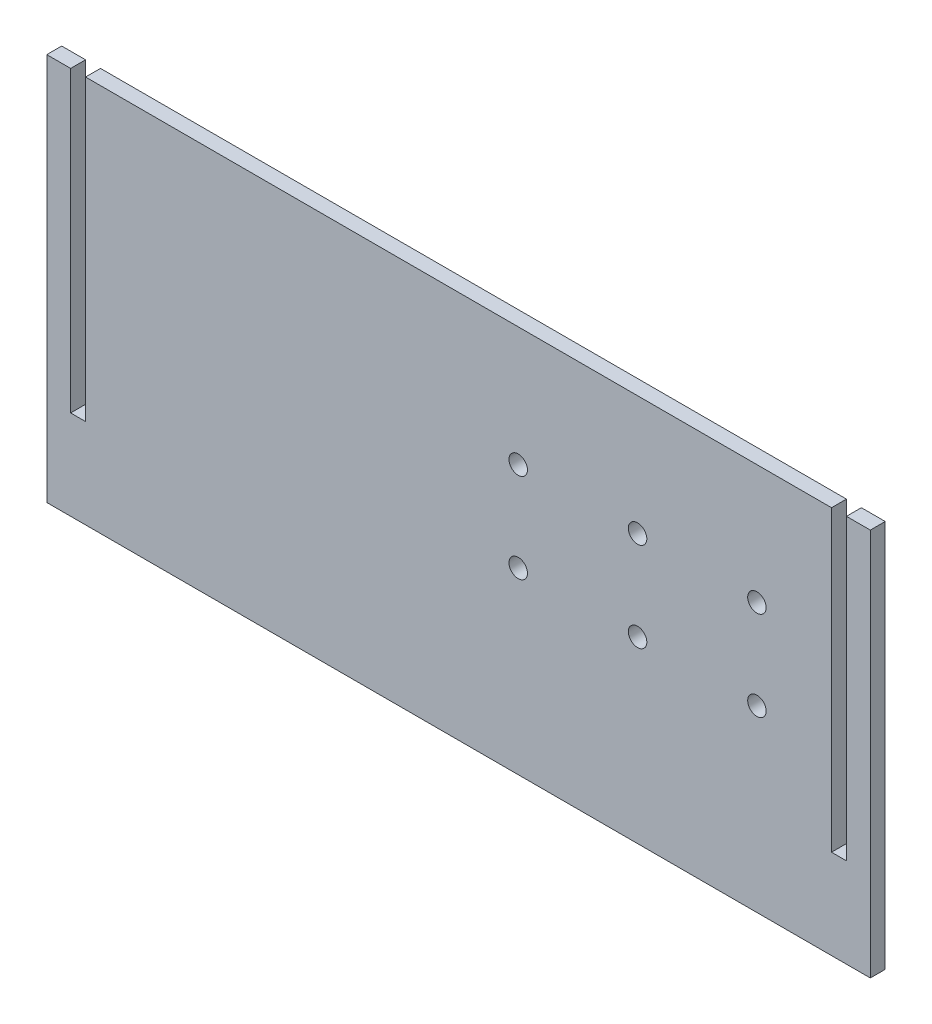
from build123d import *

# Parameters (mm, degrees)
CROQUIS1_W              = 138
CROQUIS1_H              = 65
SALIENTE_EXTRUIR1_DEPTH = 2.5
CROQUIS2_W              = 2.5
CROQUIS2_H              = 50
CORTAR_EXTRUIR1_DEPTH   = 2.5
CROQUIS3_R              = 1.55
CORTAR_EXTRUIR2_DEPTH   = 153.562282364


with BuildPart() as part:
    # Croquis1 → Saliente-Extruir1 (new body)
    with BuildSketch(Plane.XY):
        with Locations((69, -32.5)):
            Rectangle(CROQUIS1_W, CROQUIS1_H)
    extrude(amount=SALIENTE_EXTRUIR1_DEPTH)

    # Croquis2 → Cortar-Extruir1 (cut)
    with BuildSketch(Plane.XY.offset(2.5)):
        with Locations((5.25, -25)):
            Rectangle(CROQUIS2_W, CROQUIS2_H)
        with Locations((132.75, -24.997545264)):
            Rectangle(CROQUIS2_W, CROQUIS2_H)
    extrude(amount=-CORTAR_EXTRUIR1_DEPTH, mode=Mode.SUBTRACT)

    # Croquis3 → Cortar-Extruir2 (cut, through all)
    with BuildSketch(Plane.XY.offset(2.5)):
        with Locations((119, -35)):
            Circle(CROQUIS3_R)
        with Locations((119, -20)):
            Circle(CROQUIS3_R)
        with Locations((99, -35)):
            Circle(CROQUIS3_R)
        with Locations((99, -20)):
            Circle(CROQUIS3_R)
        with Locations((79, -35)):
            Circle(CROQUIS3_R)
        with Locations((79, -20)):
            Circle(CROQUIS3_R)
    extrude(amount=-CORTAR_EXTRUIR2_DEPTH, mode=Mode.SUBTRACT)


solid = part.part
